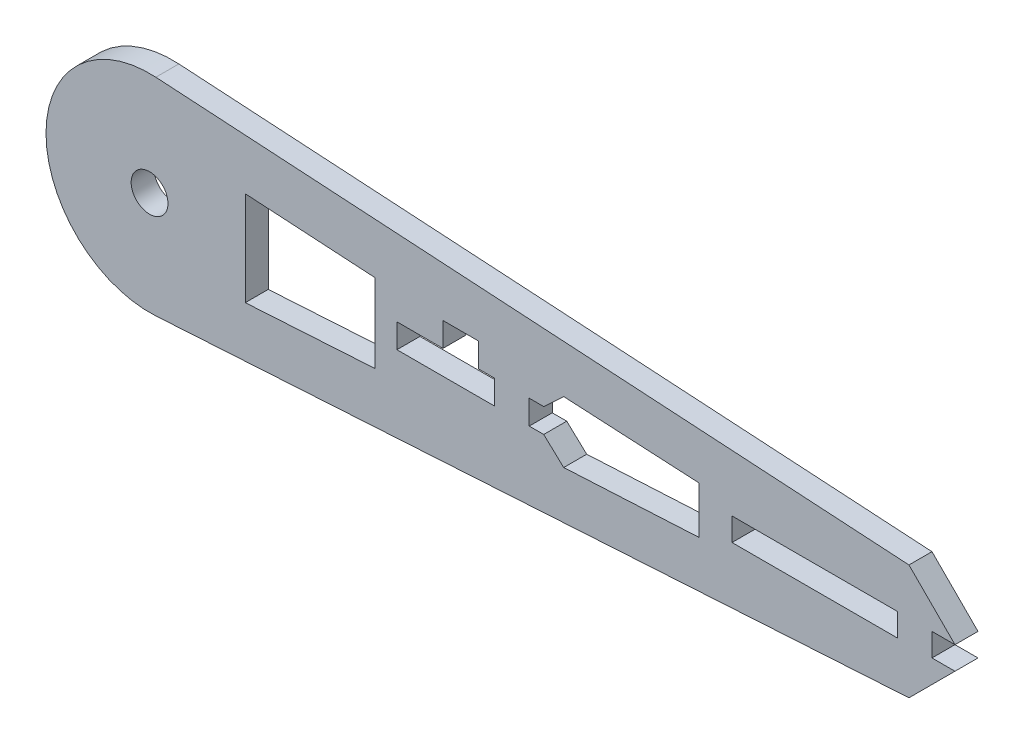
from build123d import *

# Parameters (mm, degrees)
SKETCH_1_R      = 1.6
SKETCH_1_W      = 14.377962021
SKETCH_1_H      = 2
EXTRUDE_1_DEPTH = 2


with BuildPart() as part:
    # 草图1 → 凸台-拉伸1 (new body)
    with BuildSketch(Plane.XY):
        with BuildLine():
            Line((68, 1), (70, 1))
            Line((70, 1), (66, 5))
            Line((66, 5), (0.546713687, 8.983379328))
            ThreePointArc((0.546713687, 8.983379328), (-9, 0), (0.546713687, -8.983379328))
            Line((0.546713687, -8.983379328), (66, -5))
            Line((66, -5), (70, -1))
            Line((70, -1), (68, -1))
            Line((68, -1), (68, 1))
        make_face()
        Circle(SKETCH_1_R, mode=Mode.SUBTRACT)
        Polygon((30, 1.05), (28.6, 1.05), (28.6, 3.15), (25.5, 3.15), (25.5, 1.05), (21.5, 1.05), (21.5, -1.05), (30, -1.05), align=None, mode=Mode.SUBTRACT)
        Polygon((8.317846196, 4.101632549), (19.58225642, 3.420369402), (19.58225642, -3.420369402), (8.317846196, -4.101632549), align=None, mode=Mode.SUBTRACT)
        with Locations((57.811018989, 0)):
            Rectangle(SKETCH_1_W, SKETCH_1_H, mode=Mode.SUBTRACT)
        Polygon((47.752262622, -2.05), (35.993942407, -2.669181187), (34.25663283, -1.05), (32.998759736, -1.05), (32.998759736, 1.05), (34.25663283, 1.05), (35.993942407, 2.669181187), (47.752262622, 2.05), align=None, mode=Mode.SUBTRACT)
    extrude(amount=EXTRUDE_1_DEPTH)


solid = part.part
